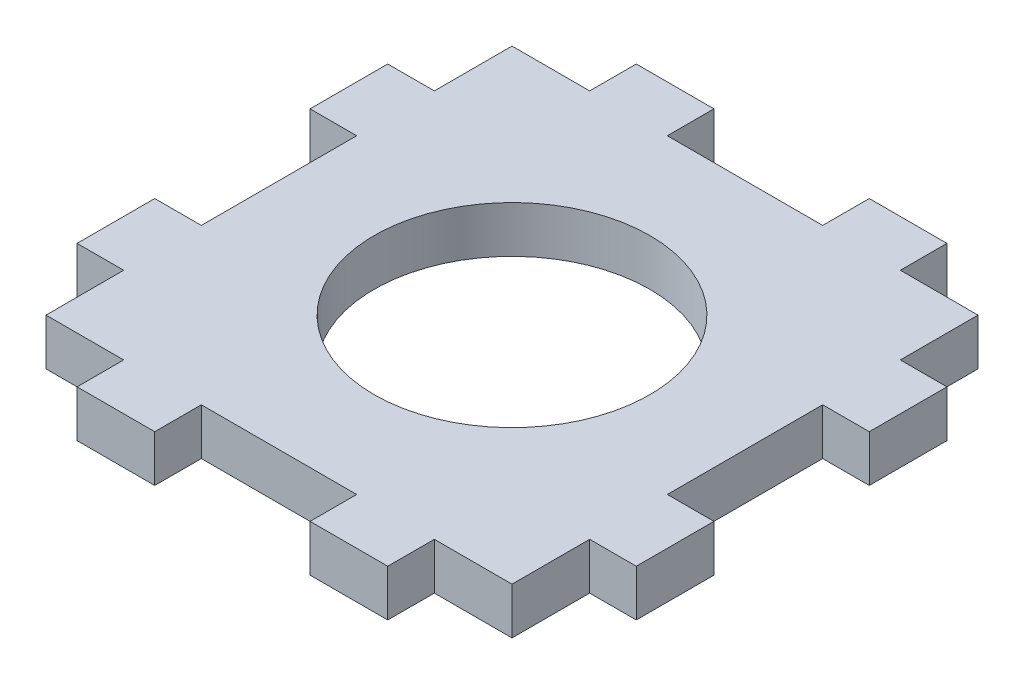
from build123d import *

# Parameters (mm, degrees)
SKETCH1_W           = 60
SKETCH1_H           = 60
SKETCH1_R           = 17.75
SKETCH1_W_2         = 10
SKETCH1_H_2         = 6
SKETCH1_W_3         = 6
SKETCH1_H_3         = 10
BOSS_EXTRUDE1_DEPTH = 6


with BuildPart() as part:
    # Sketch1 → Boss-Extrude1 (new body)
    # profile 1 of 9: a face of its own
    with BuildSketch(Plane(origin=(0, 0, 0), x_dir=(1, 0, 0), z_dir=(0, 1, 0))):
        Rectangle(SKETCH1_W, SKETCH1_H)
        with Locations(Location((0, 0, 0), (0, 0, 270))):
            Circle(SKETCH1_R, mode=Mode.SUBTRACT)
    # profile 2 of 9: a face of its own
    with BuildSketch(Plane(origin=(0, 0, 0), x_dir=(1, 0, 0), z_dir=(0, 1, 0))):
        with Locations((15, -33)):
            Rectangle(SKETCH1_W_2, SKETCH1_H_2)
    # profile 3 of 9: a face of its own
    with BuildSketch(Plane(origin=(0, 0, 0), x_dir=(1, 0, 0), z_dir=(0, 1, 0))):
        with Locations((-15, -33)):
            Rectangle(SKETCH1_W_2, SKETCH1_H_2)
    # profile 4 of 9: a face of its own
    with BuildSketch(Plane(origin=(0, 0, 0), x_dir=(1, 0, 0), z_dir=(0, 1, 0))):
        with Locations((-33, -15)):
            Rectangle(SKETCH1_W_3, SKETCH1_H_3)
    # profile 5 of 9: a face of its own
    with BuildSketch(Plane(origin=(0, 0, 0), x_dir=(1, 0, 0), z_dir=(0, 1, 0))):
        with Locations((-33, 15)):
            Rectangle(SKETCH1_W_3, SKETCH1_H_3)
    # profile 6 of 9: a face of its own
    with BuildSketch(Plane(origin=(0, 0, 0), x_dir=(1, 0, 0), z_dir=(0, 1, 0))):
        with Locations((-15, 33)):
            Rectangle(SKETCH1_W_2, SKETCH1_H_2)
    # profile 7 of 9: a face of its own
    with BuildSketch(Plane(origin=(0, 0, 0), x_dir=(1, 0, 0), z_dir=(0, 1, 0))):
        with Locations((15, 33)):
            Rectangle(SKETCH1_W_2, SKETCH1_H_2)
    # profile 8 of 9: a face of its own
    with BuildSketch(Plane(origin=(0, 0, 0), x_dir=(1, 0, 0), z_dir=(0, 1, 0))):
        with Locations((33, 15)):
            Rectangle(SKETCH1_W_3, SKETCH1_H_3)
    # profile 9 of 9: a face of its own
    with BuildSketch(Plane(origin=(0, 0, 0), x_dir=(1, 0, 0), z_dir=(0, 1, 0))):
        with Locations((33, -15)):
            Rectangle(SKETCH1_W_3, SKETCH1_H_3)
    extrude(amount=BOSS_EXTRUDE1_DEPTH)


solid = part.part
